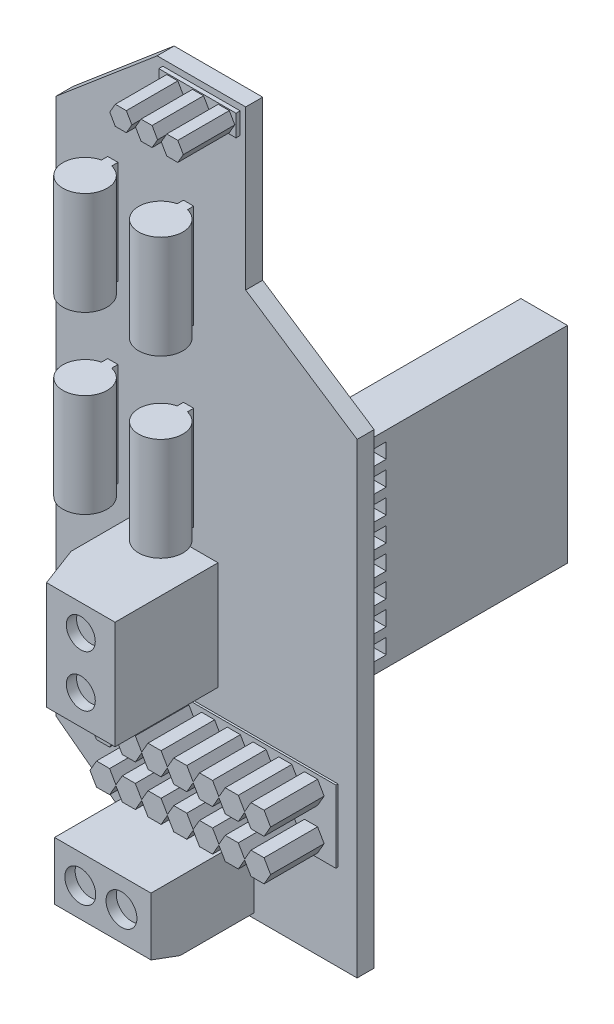
from build123d import *

# Parameters (mm, degrees)
BOSS_EXTRU_1_DEPTH         = 1.65
ESQUISSE2_W                = 7.500542548
ESQUISSE2_H                = 2.07803642
ESQUISSE2_W_2              = 4.5
ESQUISSE2_H_2              = 10
ESQUISSE2_W_3              = 19
ESQUISSE2_H_3              = 7
BOSS_EXTRU_2_DEPTH         = 5.4
ESQUISSE3_W                = 9.367878724
ESQUISSE3_H                = 6.668659431
ESQUISSE3_W_2              = 8.09765788
ESQUISSE3_H_2              = 10.479321963
BOSS_EXTRU_3_DEPTH         = 10
ESQUISSE4_W                = 4.52
ESQUISSE4_H                = 20
BOSS_EXTRU_4_DEPTH         = 21.6
ENL_V_MAT_EXTRU_3_DEPTH    = 27
ENL_V_MAT_EXTRU_4_DEPTH    = 27
ESQUISSE8_W                = 19
ESQUISSE8_H                = 7
ENL_V_MAT_EXTRU_10_DEPTH   = 5.2
ESQUISSE9_W                = 4.720838782
ESQUISSE9_H                = 3.408142922
ENL_V_MAT_EXTRU_11_DEPTH   = 5.2
ENL_V_MAT_EXTRU_12_DEPTH   = 10.479321963
ESQUISSE11_R               = 1.408882025
ENL_V_MAT_EXTRU_13_DEPTH   = 1
ESQUISSE12_W               = 4
ESQUISSE12_H               = 1.473535915
ENL_V_MAT_EXTRU_14_DEPTH   = 5
R_P_TITION_LIN_AIRE2_COUNT = 8
R_P_TITION_LIN_AIRE2_PITCH = 2.35
ESQUISSE13_W               = 7.500542548
ESQUISSE13_H               = 2.07803642
ENL_V_MAT_EXTRU_15_DEPTH   = 5
ESQUISSE14_W               = 3.271331769
ESQUISSE14_H               = 4.060085723
ENL_V_MAT_EXTRU_16_DEPTH   = 4
ENL_V_MAT_EXTRU_17_DEPTH   = 9.367878724
ESQUISSE16_R               = 1.5
ENL_V_MAT_EXTRU_18_DEPTH   = 1
ESQUISSE17_W               = 3.885061181
ESQUISSE17_H               = 2.731391292
BOSS_EXTRU_5_DEPTH         = 4
ESQUISSE18_W               = 0.920882747
ESQUISSE18_H               = 2.290117501
ESQUISSE18_H_2             = 2.160502476
ENL_V_MAT_EXTRU_19_DEPTH   = 2


with BuildPart() as part:
    # Esquisse1 → Boss.-Extru.1 (new body)
    with BuildSketch(Plane.XY):
        Polygon((-11.322996827, 33.479919825), (-2.722996827, 33.479919825), (-2.722996827, 18.079919825), (8.097003173, 10.929190962), (8.097003173, -34.370080175), (-11.322996827, -34.370080175), (-21.142996827, -26.970080175), (-21.142996827, 25.17175656), align=None)
    extrude(amount=BOSS_EXTRU_1_DEPTH)

    # Esquisse2 → Boss.-Extru.2 (add)
    with BuildSketch(Plane.XY.offset(1.65)):
        with Locations((-7.014060798, 31.844772067)):
            Rectangle(ESQUISSE2_W, ESQUISSE2_H)
        with Locations((-15.625595621, 17.61587245)):
            Rectangle(ESQUISSE2_W_2, ESQUISSE2_H_2)
        with Locations((-8.269550488, 17.61587245)):
            Rectangle(ESQUISSE2_W_2, ESQUISSE2_H_2)
        with Locations((-15.625595621, 0.61587245)):
            Rectangle(ESQUISSE2_W_2, ESQUISSE2_H_2)
        with Locations((-8.269550488, 0.61587245)):
            Rectangle(ESQUISSE2_W_2, ESQUISSE2_H_2)
        with Locations((-3.263789524, -22.475472938)):
            Rectangle(ESQUISSE2_W_3, ESQUISSE2_H_3)
    extrude(amount=BOSS_EXTRU_2_DEPTH)

    # Esquisse3 → Boss.-Extru.3 (add)
    with BuildSketch(Plane.XY.offset(1.65)):
        with Locations((-6.60238563, -30.573130819)):
            Rectangle(ESQUISSE3_W, ESQUISSE3_H)
        with Locations((-9.460382529, -11.440429356)):
            Rectangle(ESQUISSE3_W_2, ESQUISSE3_H_2)
    extrude(amount=BOSS_EXTRU_3_DEPTH)

    # Esquisse4 → Boss.-Extru.4 (add)
    with BuildSketch(Plane(origin=(0, 0, 0), x_dir=(-1, 0, 0), z_dir=(0, 0, -1))):
        with Locations((-3.017003173, -2.520080175)):
            Rectangle(ESQUISSE4_W, ESQUISSE4_H)
    extrude(amount=BOSS_EXTRU_4_DEPTH)

    # Esquisse5 → Enlèv. mat.-Extru.3 (cut)
    with BuildSketch(Plane.XZ.offset(4.38412755)):
        with BuildLine():
            Line((-16.125595621, 1.65), (-16.125595621, 2.258947633))
            ThreePointArc((-16.125595621, 2.258947633), (-16.957417681, 6.037824043), (-13.475595621, 4.35))
            ThreePointArc((-13.475595621, 4.35), (-13.937771578, 3.01817794), (-15.125595621, 2.258947633))
            Line((-15.125595621, 2.258947633), (-15.125595621, 1.65))
            Line((-15.125595621, 1.65), (-13.375595621, 1.65))
            Line((-13.375595621, 1.65), (-13.375595621, 7.05))
            Line((-13.375595621, 7.05), (-17.875595621, 7.05))
            Line((-17.875595621, 7.05), (-17.875595621, 1.65))
            Line((-17.875595621, 1.65), (-16.125595621, 1.65))
        make_face()
    extrude(amount=-ENL_V_MAT_EXTRU_3_DEPTH, mode=Mode.SUBTRACT)

    # Esquisse6 → Enlèv. mat.-Extru.4 (cut)
    with BuildSketch(Plane(origin=(0, 22.61587245, 0), x_dir=(1, 0, 0), z_dir=(0, 1, 0))):
        with BuildLine():
            Line((-7.769550488, -1.65), (-7.769550488, -2.258947633))
            ThreePointArc((-7.769550488, -2.258947633), (-6.581726445, -3.01817794), (-6.119550488, -4.35))
            ThreePointArc((-6.119550488, -4.35), (-9.601372548, -6.037824043), (-8.769550488, -2.258947633))
            Line((-8.769550488, -2.258947633), (-8.769550488, -1.65))
            Line((-8.769550488, -1.65), (-10.519550488, -1.65))
            Line((-10.519550488, -1.65), (-10.519550488, -7.05))
            Line((-10.519550488, -7.05), (-6.019550488, -7.05))
            Line((-6.019550488, -7.05), (-6.019550488, -1.65))
            Line((-6.019550488, -1.65), (-7.769550488, -1.65))
        make_face()
    extrude(amount=-ENL_V_MAT_EXTRU_4_DEPTH, mode=Mode.SUBTRACT)

    # Esquisse8 → Enlèv. mat.-Extru.10 (cut)
    with BuildSketch(Plane.XY.offset(7.05)):
        with Locations((-3.263789524, -22.475472938)):
            Rectangle(ESQUISSE8_W, ESQUISSE8_H)
        Polygon((-9.310926333, -23.372293681), (-8.039683442, -23.372293681), (-7.425304887, -24.436428552), (-6.810926333, -23.372293681), (-5.539683442, -23.372293681), (-4.925304887, -24.436428552), (-4.310926333, -23.372293681), (-3.039683442, -23.372293681), (-2.425304887, -24.436428552), (-1.810926333, -23.372293681), (-0.539683442, -23.372293681), (0.074695113, -24.436428552), (0.689073667, -23.372293681), (1.960316558, -23.372293681), (2.574695113, -24.436428552), (3.189073667, -23.372293681), (4.460316558, -23.372293681), (5.095938004, -24.473222319), (4.460316558, -25.574150957), (3.189073667, -25.574150957), (2.574695113, -24.510016086), (1.960316558, -25.574150957), (0.689073667, -25.574150957), (0.074695113, -24.510016086), (-0.539683442, -25.574150957), (-1.810926333, -25.574150957), (-2.425304887, -24.510016086), (-3.039683442, -25.574150957), (-4.310926333, -25.574150957), (-4.925304887, -24.510016086), (-5.539683442, -25.574150957), (-6.810926333, -25.574150957), (-7.425304887, -24.510016086), (-8.039683442, -25.574150957), (-9.310926333, -25.574150957), (-9.925304887, -24.510016086), (-10.539683442, -25.574150957), (-11.810926333, -25.574150957), (-12.446547779, -24.473222319), (-11.810926333, -23.372293681), (-10.539683442, -23.372293681), (-9.925304887, -24.436428552), align=None, mode=Mode.SUBTRACT)
        Polygon((-11.810926333, -19.372293681), (-10.539683442, -19.372293681), (-9.925304887, -20.436428552), (-9.310926333, -19.372293681), (-8.039683442, -19.372293681), (-7.425304887, -20.436428552), (-6.810926333, -19.372293681), (-5.539683442, -19.372293681), (-4.925304887, -20.436428552), (-4.310926333, -19.372293681), (-3.039683442, -19.372293681), (-2.425304887, -20.436428552), (-1.810926333, -19.372293681), (-0.539683442, -19.372293681), (0.074695113, -20.436428552), (0.689073667, -19.372293681), (1.960316558, -19.372293681), (2.574695113, -20.436428552), (3.189073667, -19.372293681), (4.460316558, -19.372293681), (5.095938004, -20.473222319), (4.460316558, -21.574150957), (3.189073667, -21.574150957), (2.574695113, -20.510016086), (1.960316558, -21.574150957), (0.689073667, -21.574150957), (0.074695113, -20.510016086), (-0.539683442, -21.574150957), (-1.810926333, -21.574150957), (-2.425304887, -20.510016086), (-3.039683442, -21.574150957), (-4.310926333, -21.574150957), (-4.925304887, -20.510016086), (-5.539683442, -21.574150957), (-6.810926333, -21.574150957), (-7.425304887, -20.510016086), (-8.039683442, -21.574150957), (-9.310926333, -21.574150957), (-9.925304887, -20.510016086), (-10.539683442, -21.574150957), (-11.810926333, -21.574150957), (-12.446547779, -20.473222319), align=None, mode=Mode.SUBTRACT)
    extrude(amount=-ENL_V_MAT_EXTRU_10_DEPTH, mode=Mode.SUBTRACT)

    # Esquisse9 → Enlèv. mat.-Extru.11 (cut)
    with BuildSketch(Plane.ZY.offset(13.509211469)):
        with Locations((4.816906229, -9.200768374)):
            Rectangle(ESQUISSE9_W, ESQUISSE9_H)
        with Locations((4.816906229, -13.200768374)):
            Rectangle(ESQUISSE9_W, ESQUISSE9_H)
    extrude(amount=-ENL_V_MAT_EXTRU_11_DEPTH, mode=Mode.SUBTRACT)

    # Esquisse10 → Enlèv. mat.-Extru.12 (cut)
    with BuildSketch(Plane.XZ.offset(16.680090337)):
        Polygon((-13.509211469, 11.65), (-13.509211469, 7.824763107), (-12.064456288, 11.65), align=None)
    extrude(amount=-ENL_V_MAT_EXTRU_12_DEPTH, mode=Mode.SUBTRACT)

    # Esquisse11 → Enlèv. mat.-Extru.13 (cut)
    with BuildSketch(Plane.XY.offset(11.65)):
        with Locations((-8.738004938, -8.783286134)):
            Circle(ESQUISSE11_R)
        with Locations((-8.738004938, -13.783286134)):
            Circle(ESQUISSE11_R)
    extrude(amount=-ENL_V_MAT_EXTRU_13_DEPTH, mode=Mode.SUBTRACT)

    # Esquisse12 → Enlèv. mat.-Extru.14 (cut)
    with BuildSketch(Plane(origin=(5.277003173, 0, 0), x_dir=(0, 0, -1), z_dir=(1, 0, 0))):
        with Locations((2, -10.686941774)):
            Rectangle(ESQUISSE12_W, ESQUISSE12_H)
    enl_v_mat_extru_14 = extrude(amount=-ENL_V_MAT_EXTRU_14_DEPTH, mode=Mode.SUBTRACT)

    # Répétition linéaire2: Enlèv. mat.-Extru.14 ×8
    with Locations(*[(0, i * R_P_TITION_LIN_AIRE2_PITCH, 0) for i in range(1, R_P_TITION_LIN_AIRE2_COUNT)]):
        add(enl_v_mat_extru_14, mode=Mode.SUBTRACT)

    # Esquisse13 → Enlèv. mat.-Extru.15 (cut)
    with BuildSketch(Plane.XY.offset(7.05)):
        with Locations((-7.014060798, 31.844772067)):
            Rectangle(ESQUISSE13_W, ESQUISSE13_H)
        Polygon((-4.987680658, 30.91539825), (-3.914532212, 30.91539825), (-3.377957988, 31.844772067), (-3.914532212, 32.774145883), (-4.987680658, 32.774145883), (-5.524254881, 31.844772067), align=None, mode=Mode.SUBTRACT)
        Polygon((-7.487680658, 30.91539825), (-6.414532212, 30.91539825), (-5.877957988, 31.844772067), (-6.414532212, 32.774145883), (-7.487680658, 32.774145883), (-8.024254881, 31.844772067), align=None, mode=Mode.SUBTRACT)
        Polygon((-9.987680658, 30.91539825), (-8.914532212, 30.91539825), (-8.377957988, 31.844772067), (-8.914532212, 32.774145883), (-9.987680658, 32.774145883), (-10.524254881, 31.844772067), align=None, mode=Mode.SUBTRACT)
    extrude(amount=-ENL_V_MAT_EXTRU_15_DEPTH, mode=Mode.SUBTRACT)

    # Esquisse14 → Enlèv. mat.-Extru.16 (cut)
    with BuildSketch(Plane.XZ.offset(33.907460534)):
        with Locations((-8.786324993, 5.323009837)):
            Rectangle(ESQUISSE14_W, ESQUISSE14_H)
        with Locations((-4.786324993, 5.323009837)):
            Rectangle(ESQUISSE14_W, ESQUISSE14_H)
    extrude(amount=-ENL_V_MAT_EXTRU_16_DEPTH, mode=Mode.SUBTRACT)

    # Esquisse15 → Enlèv. mat.-Extru.17 (cut)
    with BuildSketch(Plane.ZY.offset(11.286324992)):
        Polygon((11.65, -33.907460534), (8.82735213, -33.907460534), (11.65, -32.862899256), align=None)
    extrude(amount=-ENL_V_MAT_EXTRU_17_DEPTH, mode=Mode.SUBTRACT)

    # Esquisse16 → Enlèv. mat.-Extru.18 (cut)
    with BuildSketch(Plane.XY.offset(11.65)):
        with Locations((-8.786324992, -30.050850179)):
            Circle(ESQUISSE16_R)
        with Locations((-4.786324992, -30.050850179)):
            Circle(ESQUISSE16_R)
    extrude(amount=-ENL_V_MAT_EXTRU_18_DEPTH, mode=Mode.SUBTRACT)

    # Esquisse17 → Boss.-Extru.5 (add)
    with BuildSketch(Plane.XY.offset(2.456486838)):
        with Locations((-10.608721449, -9.092293052)):
            Rectangle(ESQUISSE17_W, ESQUISSE17_H)
        with Locations((-10.608721449, -13.220994575)):
            Rectangle(ESQUISSE17_W, ESQUISSE17_H)
    extrude(amount=BOSS_EXTRU_5_DEPTH)

    # Esquisse18 → Enlèv. mat.-Extru.19 (cut)
    with BuildSketch(Plane.ZY.offset(12.551252039)):
        with Locations((4.443169064, -9.003269943)):
            Rectangle(ESQUISSE18_W, ESQUISSE18_H)
        with Locations((4.443169064, -13.213111598)):
            Rectangle(ESQUISSE18_W, ESQUISSE18_H_2)
    extrude(amount=-ENL_V_MAT_EXTRU_19_DEPTH, mode=Mode.SUBTRACT)


solid = part.part
